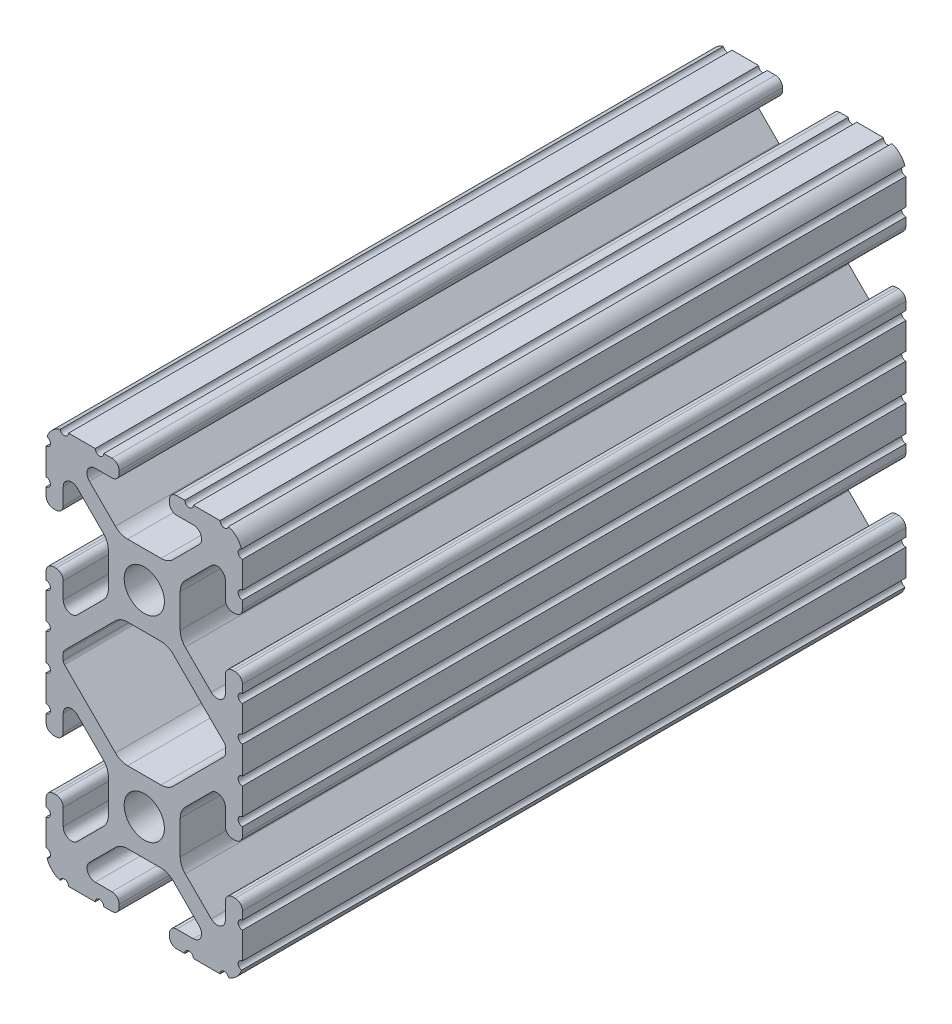
from build123d import *

# Parameters (mm, degrees)
BOSS_EXTRUDE1_DEPTH     = 76.2
CUT_EXTRUDE1_DEPTH      = 82.319677815
CUT_EXTRUDE1_DEPTH_BACK = 82.319677815
SKETCH5_R               = 0.55245
BOSS_EXTRUDE2_DEPTH     = 76.2
CUT_EXTRUDE2_DEPTH      = 82.319677815
CUT_EXTRUDE2_DEPTH_BACK = 82.319677815
SKETCH8_W               = 48.4456509
SKETCH8_H               = 64.339711884
CUT_EXTRUDE3_DEPTH      = 66.548


with BuildPart() as part:
    # Sketch4 → Boss-Extrude1 (new, symmetric)
    with BuildSketch(Plane.XY):
        with BuildLine():
            Line((4.190365, -25.4), (10.11729625, -25.4))
            ThreePointArc((10.11729625, -25.4), (11.943543585, -24.643543585), (12.7, -22.81729625))
            Line((12.7, -22.81729625), (12.7, -16.890365))
            ThreePointArc((12.7, -16.890365), (12.42492494, -16.22627506), (11.760835, -15.9512))
            Line((11.760835, -15.9512), (11.429365, -15.9512))
            ThreePointArc((11.429365, -15.9512), (10.76527506, -16.22627506), (10.4902, -16.890365))
            Line((10.4902, -16.890365), (10.4902, -19.048478019))
            ThreePointArc((10.4902, -19.048478019), (9.830707141, -20.035478831), (8.666460301, -19.803895736))
            Line((8.666460301, -19.803895736), (5.299899128, -16.437334563))
            ThreePointArc((5.299899128, -16.437334563), (4.817571085, -15.715479634), (4.6482, -14.86399369))
            Line((4.6482, -14.86399369), (4.6482, -12.7))
            Line((4.6482, -12.7), (2.6035, -12.7))
            ThreePointArc((2.6035, -12.7), (1.840952505, -14.540952505), (0, -15.3035))
            Line((0, -15.3035), (0, -17.3482))
            Line((0, -17.3482), (2.16399369, -17.3482))
            ThreePointArc((2.16399369, -17.3482), (3.015479634, -17.517571085), (3.737334563, -17.999899128))
            Line((3.737334563, -17.999899128), (7.103895736, -21.366460301))
            ThreePointArc((7.103895736, -21.366460301), (7.335478831, -22.530707141), (6.348478019, -23.1902))
            Line((6.348478019, -23.1902), (4.190365, -23.1902))
            ThreePointArc((4.190365, -23.1902), (3.52627506, -23.46527506), (3.2512, -24.129365))
            Line((3.2512, -24.129365), (3.2512, -24.460835))
            ThreePointArc((3.2512, -24.460835), (3.52627506, -25.12492494), (4.190365, -25.4))
        make_face()
    extrude(amount=BOSS_EXTRUDE1_DEPTH, both=True)

    # Sketch5 → Cut-Extrude1 (cut, two sides: drawn at the far end of the back side and taken through both)
    with BuildSketch(Plane.XY.offset(-CUT_EXTRUDE1_DEPTH_BACK)):
        with Locations((10.356153152, -25.4)):
            Circle(SKETCH5_R)
        with Locations((5.796028019, -25.4)):
            Circle(SKETCH5_R)
        with Locations((12.7, -23.056153152)):
            Circle(SKETCH5_R)
        with Locations((12.7, -18.496028019)):
            Circle(SKETCH5_R)
    extrude(amount=CUT_EXTRUDE1_DEPTH + CUT_EXTRUDE1_DEPTH_BACK, mode=Mode.SUBTRACT)

    # Mirror1: part across plane


with BuildPart() as part_1:
    add(part.part)
    add(part.part.mirror(Plane(origin=(4.6482, -12.7, 76.2), x_dir=(0, 0, 1), z_dir=(0, -1, 0))))

    # Sketch6 → Boss-Extrude2 (add, symmetric)
    with BuildSketch(Plane.XY):
        with BuildLine():
            Line((12.7, -1.791396848), (12.7, 0))
            Line((12.7, 0), (9.803703152, 0))
            Line((9.803703152, 0), (9.803703152, -2.343846848))
            Line((9.803703152, -2.343846848), (12.14755, -2.343846848))
            ThreePointArc((12.14755, -2.343846848), (12.309358859, -1.953205706), (12.7, -1.791396848))
        make_face()
    extrude(amount=BOSS_EXTRUDE2_DEPTH, both=True)

    # Sketch7 → Cut-Extrude2 (cut, two sides: drawn at the far end of the back side and taken through both)
    with BuildSketch(Plane.XY.offset(-CUT_EXTRUDE2_DEPTH_BACK)):
        with BuildLine():
            Line((5.420615149, -5.716820286), (10.328391141, -0.809044294))
            ThreePointArc((10.328391141, -0.809044294), (10.448147248, -0.629816615), (10.4902, -0.418403152))
            Line((10.4902, -0.418403152), (10.4902, 0))
            Line((10.4902, 0), (0, 0))
            Line((0, 0), (5.420615149, -5.716820286))
        make_face()
    extrude(amount=CUT_EXTRUDE2_DEPTH + CUT_EXTRUDE2_DEPTH_BACK, mode=Mode.SUBTRACT)

    # Mirror2: part across plane


with BuildPart() as part_2:
    add(part_1.part)
    add(part_1.part.mirror(Plane.ZX))

    # Mirror3: part across plane


with BuildPart() as part_3:
    add(part_2.part)
    add(part_2.part.mirror(Plane(origin=(0, 0, 0), x_dir=(0, 0, 1), z_dir=(1, 0, 0))))

    # Sketch8 → Cut-Extrude3 (cut)
    with BuildSketch(Plane(origin=(0, 0, -76.2), x_dir=(-1, 0, 0), z_dir=(0, 0, -1))):
        Rectangle(SKETCH8_W, SKETCH8_H)
    extrude(amount=-CUT_EXTRUDE3_DEPTH, mode=Mode.SUBTRACT)


solid = part_3.part
